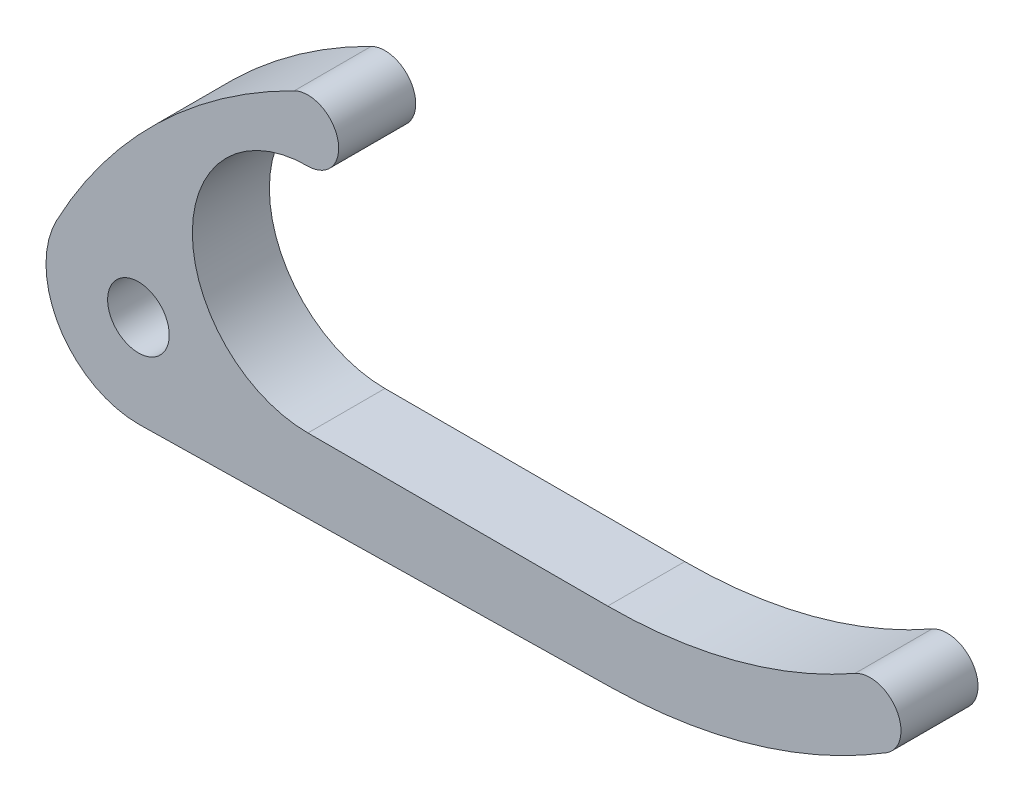
from build123d import *

# Parameters (mm, degrees)
SKETCH1_R           = 4
BOSS_EXTRUDE1_DEPTH = 10


with BuildPart() as part:
    # Sketch1 → Boss-Extrude1 (new body)
    with BuildSketch(Plane.XY):
        with BuildLine():
            ThreePointArc((-10.602156333, 5.620879031), (-10.28227962, -6.186657079), (0, -12))
            Line((0, -12), (0.41879396, -11.992689924))
            Line((0.41879396, -11.992689924), (61.391036956, -10.928415464))
            ThreePointArc((61.391036956, -10.928415464), (79.964133291, -8.081963895), (97.110947363, -0.397631709))
            ThreePointArc((97.110947363, -0.397631709), (98.438615507, 5.04350762), (93.024727532, 6.47826087))
            ThreePointArc((93.024727532, 6.47826087), (77.526052275, 0.15529838), (60.926549925, -2))
            Line((60.926549925, -2), (22, -2))
            ThreePointArc((22, -2), (7, 13), (22, 28))
            ThreePointArc((22, 28), (25.895103095, 32.910039494), (20.227651175, 35.58591406))
            ThreePointArc((20.227651175, 35.58591406), (2.455290247, 23.028888484), (-10.602156333, 5.620879031))
        make_face()
        Circle(SKETCH1_R, mode=Mode.SUBTRACT)
    extrude(amount=BOSS_EXTRUDE1_DEPTH)


solid = part.part
